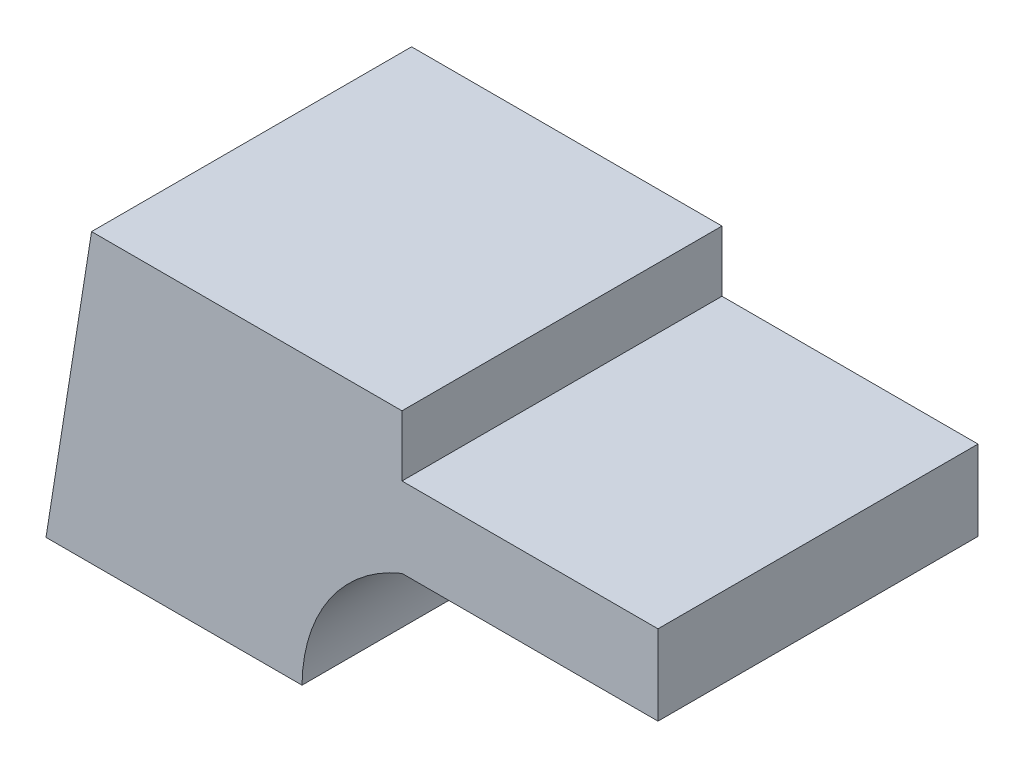
from build123d import *

# Parameters (mm, degrees)
BOSS_EXTRUDE1_DEPTH = 100
SKETCH3_W           = 80
SKETCH3_H           = 25
BOSS_EXTRUDE2_DEPTH = 100


with BuildPart() as part:
    # Sketch2 → Boss-Extrude1 (new body)
    with BuildSketch(Plane.XY):
        with BuildLine():
            Line((-54.549923262, 1.658687455), (25.450076738, 1.658687455))
            ThreePointArc((25.450076738, 1.658687455), (34.117239254, 29.330582003), (56.685613057, 47.538326449))
            Line((56.685613057, 47.538326449), (56.685613057, 91.538326449))
            Line((56.685613057, 91.538326449), (-40.314386943, 91.538326449))
            Line((-40.314386943, 91.538326449), (-54.549923262, 1.658687455))
        make_face()
    extrude(amount=BOSS_EXTRUDE1_DEPTH)

    # Sketch3 → Boss-Extrude2 (add)
    with BuildSketch(Plane(origin=(0, 0, 0), x_dir=(-1, 0, 0), z_dir=(0, 0, -1))):
        with Locations((-96.685613057, 60.038326449)):
            Rectangle(SKETCH3_W, SKETCH3_H)
    extrude(amount=-BOSS_EXTRUDE2_DEPTH)


solid = part.part
